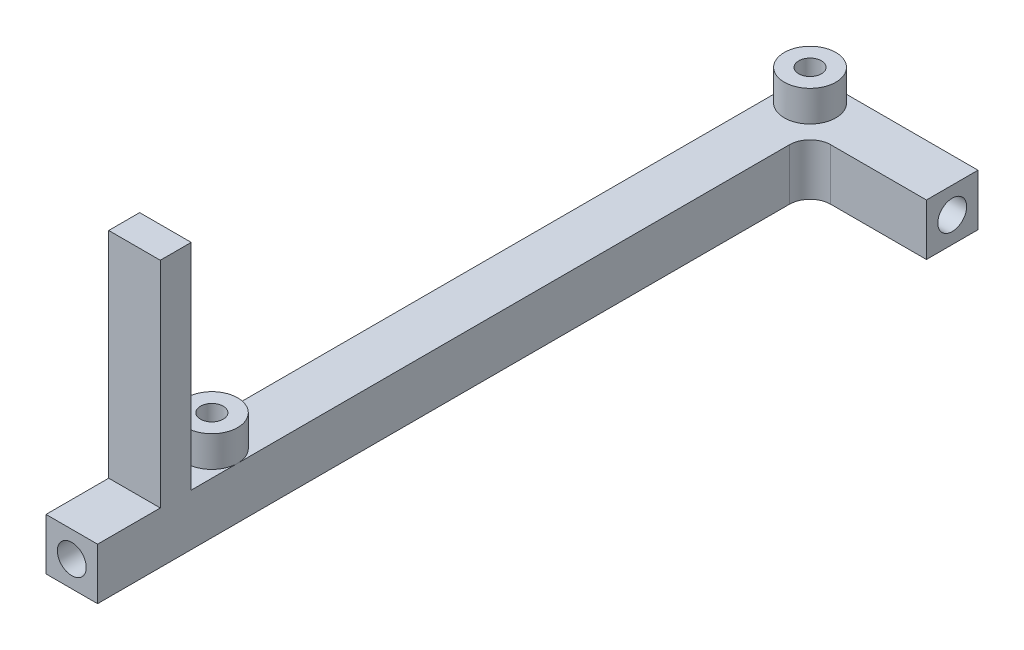
from build123d import *

# Parameters (mm, degrees)
SKETCH1_W           = 5
SKETCH1_H           = 5
BOSS_EXTRUDE1_DEPTH = 74.08
SKETCH2_R           = 1.4
CUT_EXTRUDE1_DEPTH  = 10
SKETCH3_W           = 5
SKETCH3_H           = 5
BOSS_EXTRUDE2_DEPTH = 11.28
SKETCH4_R           = 1.4
CUT_EXTRUDE2_DEPTH  = 10
SKETCH5_R           = 2.5
SKETCH5_R_2         = 1.1
BOSS_EXTRUDE3_DEPTH = 3
FILLET1_R           = 2
SKETCH7_W           = 5
SKETCH7_H           = 3
BOSS_EXTRUDE4_DEPTH = 20.8


with BuildPart() as part:
    # Sketch1 → Boss-Extrude1 (new body)
    with BuildSketch(Plane.XY):
        Rectangle(SKETCH1_W, SKETCH1_H)
    extrude(amount=BOSS_EXTRUDE1_DEPTH)

    # Sketch2 → Cut-Extrude1 (cut)
    with BuildSketch(Plane.XY.offset(74.08)):
        Circle(SKETCH2_R)
    extrude(amount=-CUT_EXTRUDE1_DEPTH, mode=Mode.SUBTRACT)

    # Sketch3 → Boss-Extrude2 (add)
    with BuildSketch(Plane(origin=(2.5, 0, 0), x_dir=(0, 0, -1), z_dir=(1, 0, 0))):
        with Locations((-2.5, 0)):
            Rectangle(SKETCH3_W, SKETCH3_H)
    extrude(amount=BOSS_EXTRUDE2_DEPTH)

    # Sketch4 → Cut-Extrude2 (cut)
    with BuildSketch(Plane(origin=(13.78, 0, 0), x_dir=(0, 0, -1), z_dir=(1, 0, 0))):
        with Locations(Location((-2.5, 0, 0), (0, 0, 90))):
            Circle(SKETCH4_R)
    extrude(amount=-CUT_EXTRUDE2_DEPTH, mode=Mode.SUBTRACT)

    # Sketch5 → Boss-Extrude3 (add)
    # profile 1 of 2: a face of its own
    with BuildSketch(Plane(origin=(0, 2.5, 0), x_dir=(1, 0, 0), z_dir=(0, 1, 0))):
        with Locations(Location((0, -60.5, 0), (0, 0, 180))):
            Circle(SKETCH5_R)
        with Locations(Location((0, -60.5, 0), (0, 0, 270))):
            Circle(SKETCH5_R_2, mode=Mode.SUBTRACT)
    # profile 2 of 2: a face of its own
    with BuildSketch(Plane(origin=(0, 2.5, 0), x_dir=(1, 0, 0), z_dir=(0, 1, 0))):
        with Locations(Location((0, -2.5, 0), (0, 0, 90))):
            Circle(SKETCH5_R)
        with Locations(Location((0, -2.5, 0), (0, 0, 270))):
            Circle(SKETCH5_R_2, mode=Mode.SUBTRACT)
    extrude(amount=BOSS_EXTRUDE3_DEPTH)

    # Fillet1
    fillet1_edges = [part.edges().sort_by_distance(p)[0] for p in [
        (2.5, 0, 5),
        (-2.5, 0, 0),
    ]]
    fillet(fillet1_edges, radius=FILLET1_R)

    # Sketch7 → Boss-Extrude4 (add)
    with BuildSketch(Plane(origin=(0, 2.5, 0), x_dir=(1, 0, 0), z_dir=(0, 1, 0))):
        with Locations((0, -66.5)):
            Rectangle(SKETCH7_W, SKETCH7_H)
    extrude(amount=BOSS_EXTRUDE4_DEPTH)


solid = part.part
